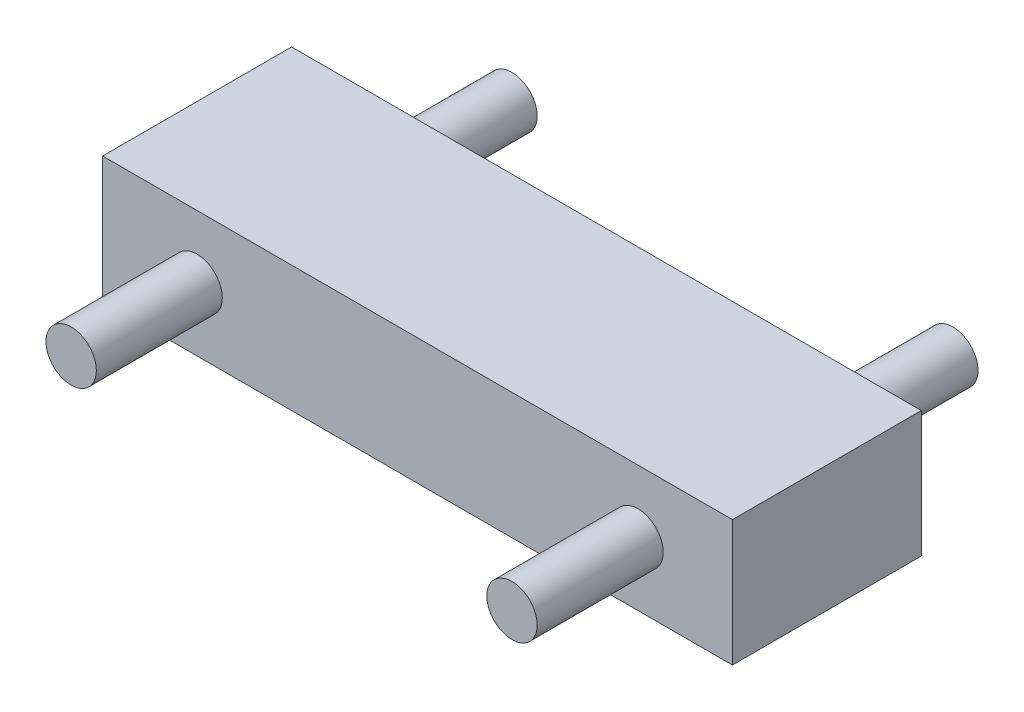
from build123d import *

# Parameters (mm, degrees)
SKETCH2_W           = 1000
SKETCH2_H           = 300
BOSS_EXTRUDE1_DEPTH = 200
SKETCH3_R           = 40
BOSS_EXTRUDE2_DEPTH = 200
BOSS_EXTRUDE3_START = 200
SKETCH5_R           = 40
BOSS_EXTRUDE3_DEPTH = 200


with BuildPart() as part:
    # Sketch2 → Boss-Extrude1 (new body)
    with BuildSketch(Plane(origin=(0, 0, 0), x_dir=(1, 0, 0), z_dir=(0, 1, 0))):
        Rectangle(SKETCH2_W, SKETCH2_H)
    extrude(amount=-BOSS_EXTRUDE1_DEPTH)

    # Sketch3 → Boss-Extrude2 (add)
    with BuildSketch(Plane.XY.offset(150)):
        with Locations((-350, -100)):
            Circle(SKETCH3_R)
        with Locations((350, -100)):
            Circle(SKETCH3_R)
    extrude(amount=BOSS_EXTRUDE2_DEPTH)

    # Sketch5 → Boss-Extrude3 (add)
    with BuildSketch(Plane(origin=(0, 0, -150), x_dir=(-1, 0, 0), z_dir=(0, 0, -1)).offset(BOSS_EXTRUDE3_START)):
        with Locations(Location((-350, -100, 0), (0, 0, 180))):
            Circle(SKETCH5_R)
        with Locations(Location((350, -100, 0), (0, 0, 180))):
            Circle(SKETCH5_R)
    extrude(amount=-BOSS_EXTRUDE3_DEPTH)


solid = part.part
